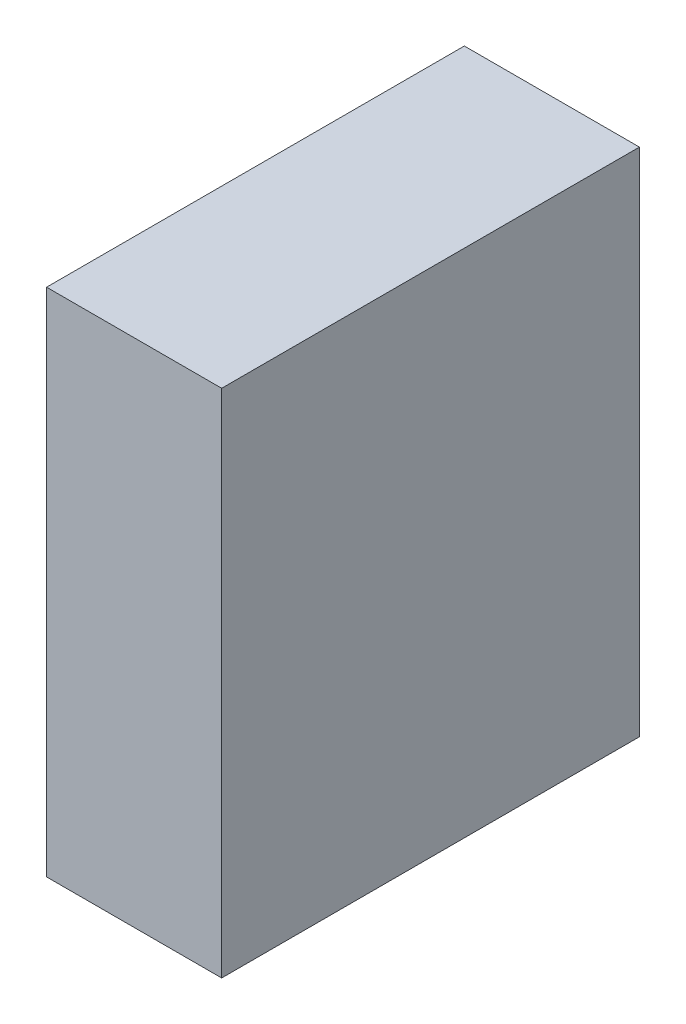
from build123d import *

# Parameters (mm, degrees)
SKETCH1_W           = 2.386090482
SKETCH1_H           = 2.917166741
BOSS_EXTRUDE1_DEPTH = 1


with BuildPart() as part:
    # Sketch1 → Boss-Extrude1 (new body)
    with BuildSketch(Plane(origin=(0, 0, 0), x_dir=(0, 0, -1), z_dir=(1, 0, 0))):
        with Locations((48.424005425, 5.243546097)):
            Rectangle(SKETCH1_W, SKETCH1_H)
    extrude(amount=BOSS_EXTRUDE1_DEPTH)


solid = part.part
